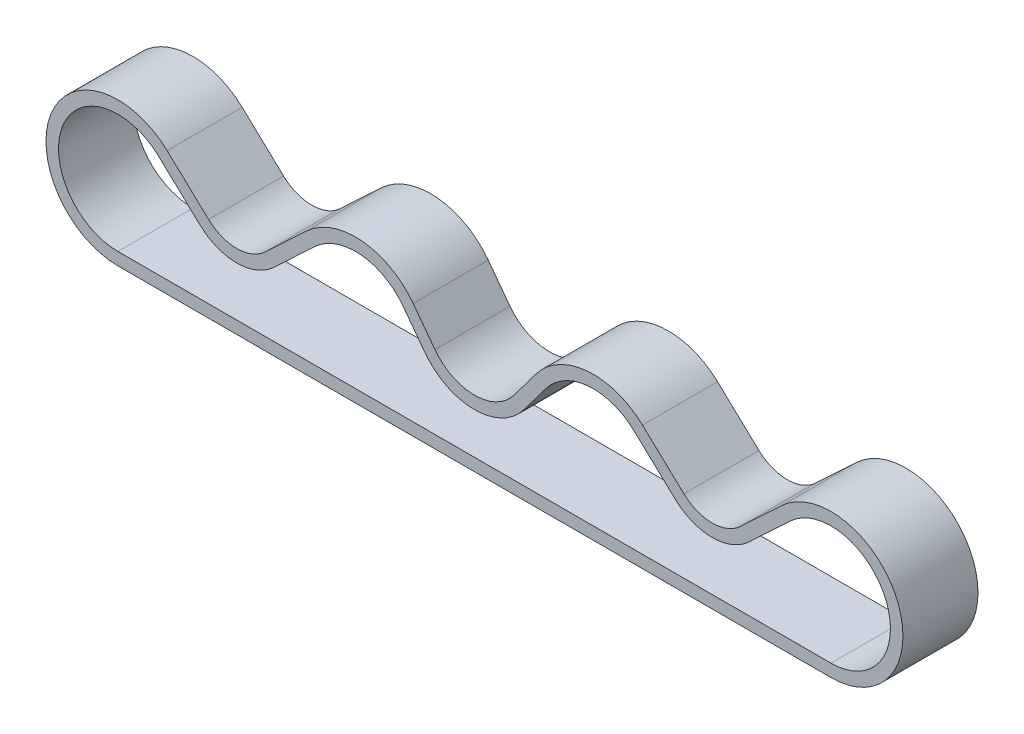
from build123d import *

# Parameters (mm, degrees)
SURFACE_EXTRUDE2_1_DEPTH = 6
THICKEN2_T1              = 1


with BuildPart() as body_1:
    # Surface-Extrude2: a surface, the sketch's curves swept straight by 6 mm
    with BuildLine(Plane.XY, mode=Mode.PRIVATE) as surface_extrude2_1_path:
        Line((-69, 0.25), (-12, 0.25))
        ThreePointArc((-12, 0.25), (-6.652714965, 8.114011059), (-15.931902505, 10.195550345))
        Line((-15.931902505, 10.195550345), (-19.243429867, 7.092118933))
        ThreePointArc((-19.243429867, 7.092118933), (-21.5, 6.2), (-23.756570133, 7.092118933))
        Line((-23.756570133, 7.092118933), (-27.068097495, 10.195550345))
        ThreePointArc((-27.068097495, 10.195550345), (-31.500549593, 11.72817162), (-35.6, 9.45))
        Line((-35.6, 9.45), (-37.34, 7.13))
        ThreePointArc((-37.34, 7.13), (-40.5, 5.55), (-43.66, 7.13))
        Line((-43.66, 7.13), (-45.4, 9.45))
        ThreePointArc((-45.4, 9.45), (-49.499450407, 11.72817162), (-53.931902505, 10.195550345))
        Line((-53.931902505, 10.195550345), (-57.243429867, 7.092118933))
        ThreePointArc((-57.243429867, 7.092118933), (-59.5, 6.2), (-61.756570133, 7.092118933))
        Line((-61.756570133, 7.092118933), (-65.068097495, 10.195550345))
        ThreePointArc((-65.068097495, 10.195550345), (-74.347285035, 8.114011059), (-69, 0.25))
    surface_extrude2_1 = Shell.extrude(surface_extrude2_1_path.wire(), (0 * SURFACE_EXTRUDE2_1_DEPTH, 0 * SURFACE_EXTRUDE2_1_DEPTH, 1 * SURFACE_EXTRUDE2_1_DEPTH))
    add(Solid.thicken(surface_extrude2_1, THICKEN2_T1))


solid = body_1.part
